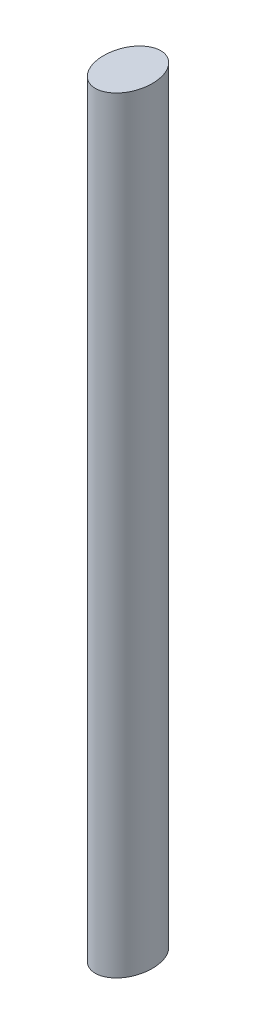
from build123d import *

# Parameters (mm, degrees)
CROQUIS2_RX             = 3.2
CROQUIS2_RY             = 2.375
SALIENTE_EXTRUIR1_DEPTH = 75


with BuildPart() as part:
    # Croquis2 → Saliente-Extruir1 (new body)
    with BuildSketch(Plane(origin=(0, 0, 0), x_dir=(1, 0, 0), z_dir=(0, 1, 0))):
        with Locations(Location((0, 0), (0, 0, 90))):
            Ellipse(CROQUIS2_RX, CROQUIS2_RY)
    extrude(amount=SALIENTE_EXTRUIR1_DEPTH)


solid = part.part
